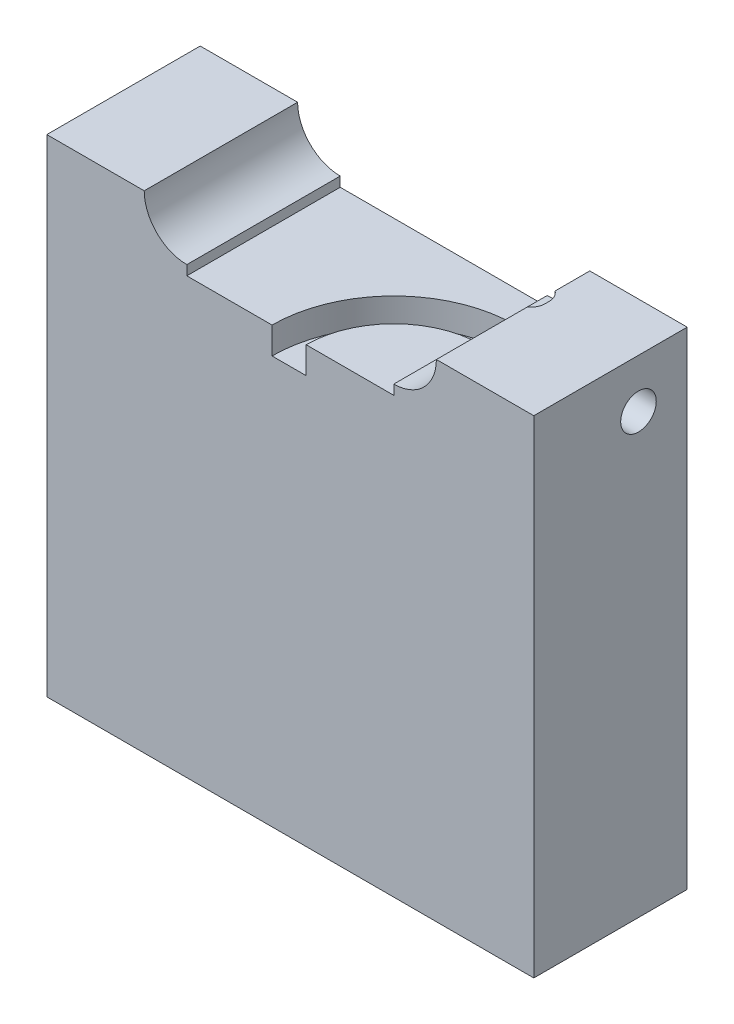
from build123d import *

# Parameters (mm, degrees)
SKETCH1_W               = 25.4
SKETCH1_H               = 8.001
BOSS_EXTRUDE1_DEPTH     = 25.4
CUT_EXTRUDE1_DEPTH      = 25.4
CUT_EXTRUDE2_DEPTH      = 27.729955228
CUT_EXTRUDE2_DEPTH_BACK = 1.905
SKETCH5_R               = 0.9271
CUT_EXTRUDE3_DEPTH      = 6.35
SKETCH6_W               = 10.795
SKETCH6_H               = 8.001
CUT_EXTRUDE4_DEPTH      = 0.508


with BuildPart() as part:
    # Sketch1 → Boss-Extrude1 (new body)
    with BuildSketch(Plane(origin=(0, 0, 0), x_dir=(1, 0, 0), z_dir=(0, 1, 0))):
        Rectangle(SKETCH1_W, SKETCH1_H)
    extrude(amount=BOSS_EXTRUDE1_DEPTH)

    # Sketch2 → Cut-Extrude1 (cut)
    with BuildSketch(Plane(origin=(0, 0, -4.0005), x_dir=(-1, 0, 0), z_dir=(0, 0, -1))):
        with BuildLine():
            Line((5.3975, 23.1775), (-5.3975, 23.1775))
            ThreePointArc((-5.3975, 23.1775), (-7.62, 25.4), (-5.3975, 27.6225))
            Line((-5.3975, 27.6225), (5.3975, 27.6225))
            ThreePointArc((5.3975, 27.6225), (7.62, 25.4), (5.3975, 23.1775))
        make_face()
    extrude(amount=-CUT_EXTRUDE1_DEPTH, mode=Mode.SUBTRACT)

    # Sketch4 → Cut-Extrude2 (cut, two sides: drawn at the far end of the back side and taken through both)
    with BuildSketch(Plane(origin=(0, 23.1775, 0), x_dir=(1, 0, 0), z_dir=(0, 1, 0)).offset(-CUT_EXTRUDE2_DEPTH_BACK)):
        with BuildLine():
            Line((0.8255, -4.0005), (-0.9525, -4.0005))
            ThreePointArc((-0.9525, -4.0005), (0.907371939, 0.489628061), (5.3975, 2.3495))
            Line((5.3975, 2.3495), (7.14375, 2.3495))
            ThreePointArc((7.14375, 2.3495), (7.705016008, 2.117016008), (7.9375, 1.55575))
            Line((7.9375, 1.55575), (7.9375, 1.36525))
            ThreePointArc((7.9375, 1.36525), (7.705016008, 0.803983992), (7.14375, 0.5715))
            Line((7.14375, 0.5715), (5.3975, 0.5715))
            ThreePointArc((5.3975, 0.5715), (2.164607796, -0.767607796), (0.8255, -4.0005))
        make_face()
    extrude(amount=CUT_EXTRUDE2_DEPTH + CUT_EXTRUDE2_DEPTH_BACK, mode=Mode.SUBTRACT)

    # Sketch5 → Cut-Extrude3 (cut)
    with BuildSketch(Plane(origin=(12.7, 0, 0), x_dir=(0, 0, -1), z_dir=(1, 0, 0))):
        with Locations((1.4605, 22.86)):
            Circle(SKETCH5_R)
    extrude(amount=-CUT_EXTRUDE3_DEPTH, mode=Mode.SUBTRACT)

    # Sketch6 → Cut-Extrude4 (cut)
    with BuildSketch(Plane(origin=(0, 23.1775, 0), x_dir=(1, 0, 0), z_dir=(0, 1, 0))):
        Rectangle(SKETCH6_W, SKETCH6_H)
    extrude(amount=-CUT_EXTRUDE4_DEPTH, mode=Mode.SUBTRACT)


solid = part.part
